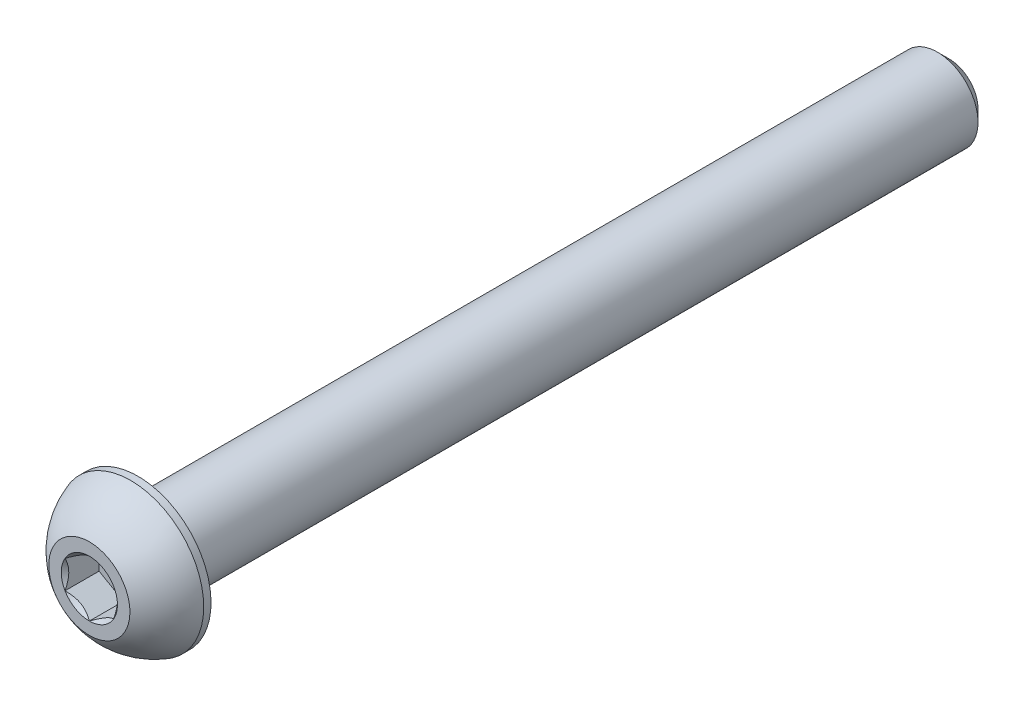
from build123d import *

# Parameters (mm, degrees)
CUT_EXTRUDE1_DEPTH = 1.05


with BuildPart() as part:
    # Sketch2 → Revolve1 (revolve)
    with BuildSketch(Plane(origin=(0, 0, 0), x_dir=(0, 0, -1), z_dir=(1, 0, 0)), mode=Mode.PRIVATE) as revolve1_sk:
        with BuildLine():
            Line((-13.25, 0), (13.25, 0))
            Line((13.25, 0), (13.25, 0.89))
            Line((13.25, 0.89), (12.89, 1.25))
            Line((12.89, 1.25), (-11.75, 1.25))
            Line((-11.75, 1.25), (-11.75, 2.25))
            Line((-11.75, 2.25), (-11.975, 2.25))
            ThreePointArc((-11.975, 2.25), (-12.700735294, 1.8625), (-13.25, 1.25))
            Line((-13.25, 1.25), (-13.25, 0))
        make_face()
    revolve(revolve1_sk.sketch.rotate(Axis((0, 0, 13.25), (0, 0, -1)), 180), axis=Axis((0, 0, 13.25), (0, 0, -1)))

    # Sketch3 → Cut-Extrude1 (cut)
    with BuildSketch(Plane.XY.offset(13.25)):
        Polygon((0, 0.866025404), (-0.75, 0.433012702), (-0.75, -0.433012702), (0, -0.866025404), (0.75, -0.433012702), (0.75, 0.433012702), align=None)
    extrude(amount=-CUT_EXTRUDE1_DEPTH, mode=Mode.SUBTRACT)

    # Cut-Extrude2 cone 1 section (through the dimple's axis) → Cut-Extrude2 (revolve, cut)
    with BuildSketch(Plane(origin=(0, 0, 13.25), x_dir=(0, -1, 0), z_dir=(1, 0, 0))):
        Polygon((0, 0), (0.866025404, 0), (0, 0.866025404), align=None)
    revolve(axis=Axis((0, 0, 13.25), (0, 0, -1)), mode=Mode.SUBTRACT)


solid = part.part
